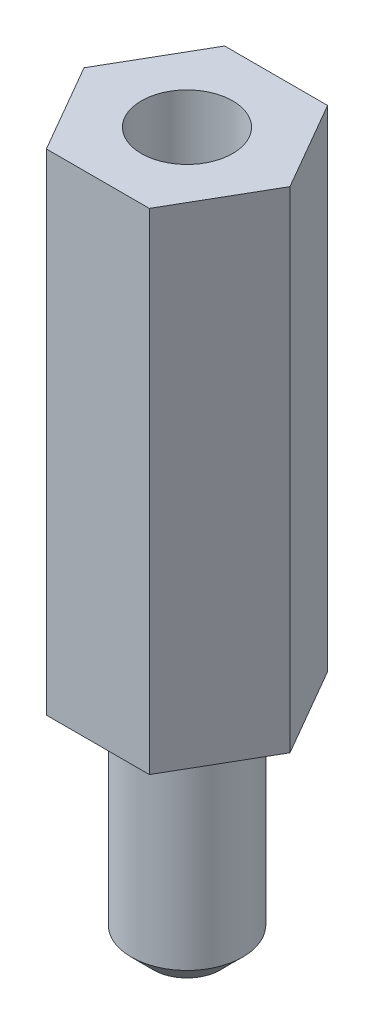
from build123d import *

# Parameters (mm, degrees)
BOSS_EXTRUDE1_DEPTH     = 11
SKETCH1_3_R             = 1.25
BOSS_EXTRUDE2_DEPTH     = 5
CHAMFER1_SIZE           = 0.5
M2_5_TAPPED_HOLE1_D     = 2.05
M2_5_TAPPED_HOLE1_DEPTH = 10
M2_5_TAPPED_HOLE1_TIP   = 0.615882135


with BuildPart() as part:
    # Sketch1 → Boss-Extrude1 (new body)
    with BuildSketch(Plane(origin=(0, 0, 0), x_dir=(1, 0, 0), z_dir=(0, 1, 0))):
        Polygon((-1.154700538, -2), (1.154700538, -2), (2.309401077, 0), (1.154700538, 2), (-1.154700538, 2), (-2.309401077, 0), align=None)
    extrude(amount=BOSS_EXTRUDE1_DEPTH)

    # Sketch1<3> → Boss-Extrude2 (add)
    with BuildSketch(Plane(origin=(0, 0, 0), x_dir=(1, 0, 0), z_dir=(0, 1, 0))):
        Circle(SKETCH1_3_R)
    extrude(amount=-BOSS_EXTRUDE2_DEPTH)

    # Chamfer1
    chamfer1_edges = [part.edges().sort_by_distance(p)[0] for p in [
        (-1.25, -5, 0),
    ]]
    chamfer(chamfer1_edges, length=CHAMFER1_SIZE)

    # M2.5 Tapped Hole1
    with Locations(Plane(origin=(0, 11, 0), x_dir=(1, 0, 0), z_dir=(0, 1, 0))):
        with Locations((0, 0)):
            Hole(M2_5_TAPPED_HOLE1_D / 2, depth=M2_5_TAPPED_HOLE1_DEPTH)
            with Locations((0, 0, -(M2_5_TAPPED_HOLE1_DEPTH + M2_5_TAPPED_HOLE1_TIP / 2))):  # 118° drill point
                Cone(0, M2_5_TAPPED_HOLE1_D / 2, M2_5_TAPPED_HOLE1_TIP, mode=Mode.SUBTRACT)


solid = part.part
